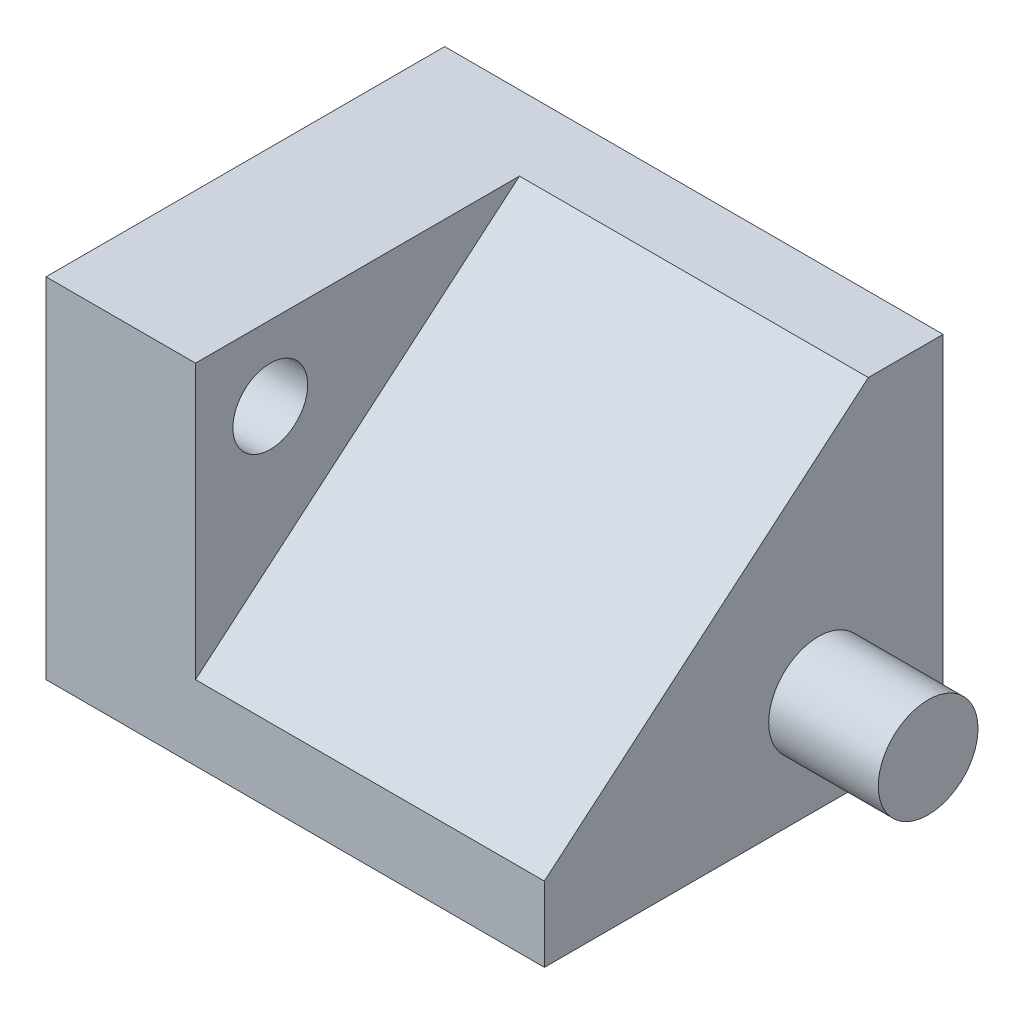
from build123d import *

# Parameters (mm, degrees)
SKETCH1_W           = 88.9
SKETCH1_H           = 82.55
BOSS_EXTRUDE1_DEPTH = 19.05
BOSS_EXTRUDE2_DEPTH = 88.9
BOSS_EXTRUDE3_DEPTH = 88.9
SKETCH5_R           = 9.525
CUT_EXTRUDE1_DEPTH  = 88.9
SKETCH6_R           = 12.7
BOSS_EXTRUDE4_DEPTH = 27.94


with BuildPart() as part:
    # Sketch1 → Boss-Extrude1 (new body)
    with BuildSketch(Plane(origin=(0, 0, 0), x_dir=(1, 0, 0), z_dir=(0, 1, 0))):
        with Locations((-44.45, 41.275)):
            Rectangle(SKETCH1_W, SKETCH1_H)
    extrude(amount=BOSS_EXTRUDE1_DEPTH)

    # Sketch1<3> → Boss-Extrude2 (add)
    with BuildSketch(Plane(origin=(0, 0, 0), x_dir=(1, 0, 0), z_dir=(0, 1, 0))):
        Polygon((-88.9, 82.55), (0, 82.55), (0, 101.6), (-127, 101.6), (-127, 82.55), (-127, 0), (-88.9, 0), align=None)
    extrude(amount=BOSS_EXTRUDE2_DEPTH)

    # Sketch2 → Boss-Extrude3 (add)
    with BuildSketch(Plane(origin=(-88.9, 0, 0), x_dir=(0, 0, -1), z_dir=(1, 0, 0))):
        Polygon((0, 19.05), (82.55, 88.9), (82.55, 19.05), align=None)
    extrude(amount=BOSS_EXTRUDE3_DEPTH)

    # Sketch5 → Cut-Extrude1 (cut)
    with BuildSketch(Plane(origin=(-88.9, 0, 0), x_dir=(0, 0, -1), z_dir=(1, 0, 0))):
        with Locations((19.05, 69.85)):
            Circle(SKETCH5_R)
    extrude(amount=-CUT_EXTRUDE1_DEPTH, mode=Mode.SUBTRACT)

    # Sketch6 → Boss-Extrude4 (add)
    with BuildSketch(Plane(origin=(0, 0, 0), x_dir=(0, 0, -1), z_dir=(1, 0, 0))):
        with Locations((69.85, 25.4)):
            Circle(SKETCH6_R)
    extrude(amount=BOSS_EXTRUDE4_DEPTH)


solid = part.part
